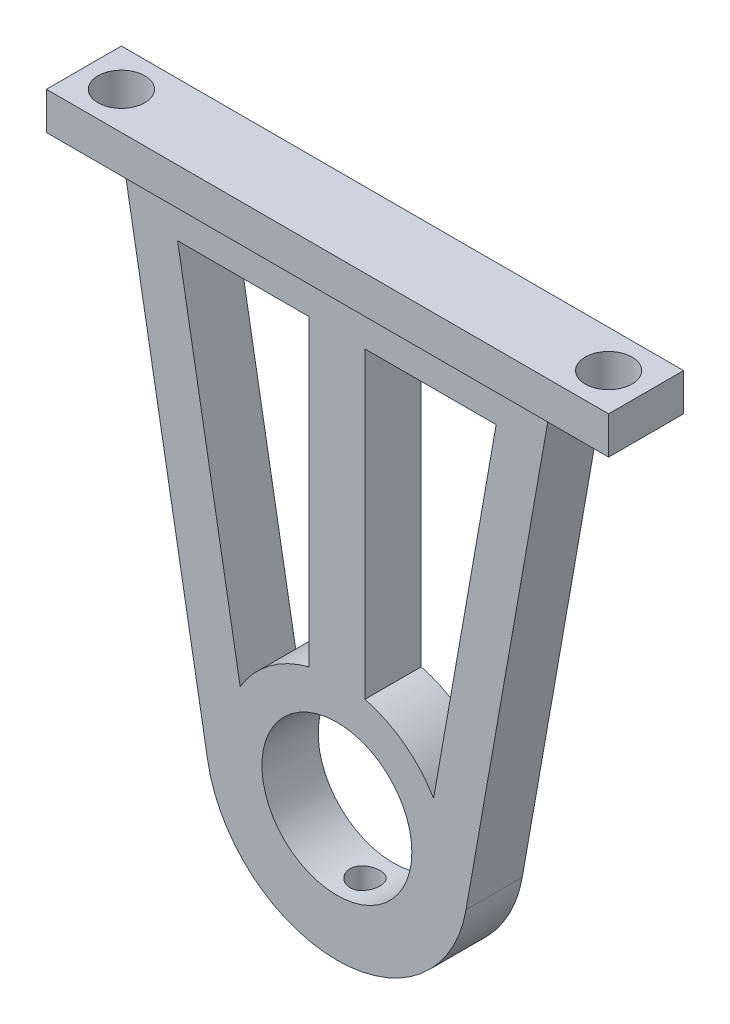
from build123d import *

# Parameters (mm, degrees)
SKETCH_1_R             = 4
EXTRUDE_1_DEPTH        = 1.5
SKETCH_2_W             = 30
SKETCH_2_H             = 4
EXTRUDE_2_DEPTH        = 2
HOLE_WIZARD_M3_1_D     = 2.5
HOLE_WIZARD_M3_1_DEPTH = 2
HOLE_WIZARD_M3_1_TIP   = 0.751075774
CUT_EXTRUDE_2_DEPTH    = 10
HOLE_WIZARD_M2_1_D     = 1.6
HOLE_WIZARD_M2_1_DEPTH = 4.2
HOLE_WIZARD_M2_1_TIP   = 0.480688495


with BuildPart() as part:
    # 草图1 → 凸台-拉伸1 (new, symmetric)
    with BuildSketch(Plane.XY):
        with BuildLine():
            Line((11.33983382, 24), (6.893654271, -1.215537244))
            ThreePointArc((6.893654271, -1.215537244), (0, -7), (-6.893654271, -1.215537244))
            Line((-6.893654271, -1.215537244), (-11.33983382, 24))
            Line((-11.33983382, 24), (11.33983382, 24))
        make_face()
        Circle(SKETCH_1_R, mode=Mode.SUBTRACT)
    extrude(amount=EXTRUDE_1_DEPTH, both=True)

    # 草图2 → 凸台-拉伸2 (add)
    with BuildSketch(Plane(origin=(0, 24, 0), x_dir=(1, 0, 0), z_dir=(0, 1, 0))):
        Rectangle(SKETCH_2_W, SKETCH_2_H)
    extrude(amount=EXTRUDE_2_DEPTH)

    # M3 螺纹孔1
    with Locations(Plane(origin=(0, 26, 0), x_dir=(1, 0, 0), z_dir=(0, 1, 0))):
        with Locations((-13, 0), (13, 0)):
            Hole(HOLE_WIZARD_M3_1_D / 2, depth=HOLE_WIZARD_M3_1_DEPTH)
            with Locations((0, 0, -(HOLE_WIZARD_M3_1_DEPTH + HOLE_WIZARD_M3_1_TIP / 2))):  # 118° drill point
                Cone(0, HOLE_WIZARD_M3_1_D / 2, HOLE_WIZARD_M3_1_TIP, mode=Mode.SUBTRACT)

    # 草图8 → 切除-拉伸2 (cut)
    with BuildSketch(Plane(origin=(0, 0, -1.5), x_dir=(-1, 0, 0), z_dir=(0, 0, -1))):
        with BuildLine():
            Line((-1.5, 22), (-8.5, 22))
            Line((-8.5, 22), (-5.160522702, 3.060883114))
            ThreePointArc((-5.160522702, 3.060883114), (-3.602683726, 4.797986033), (-1.5, 5.809475019))
            Line((-1.5, 5.809475019), (-1.5, 22))
        make_face()
        with BuildLine():
            Line((8.5, 22), (1.5, 22))
            Line((1.5, 22), (1.5, 5.809475019))
            ThreePointArc((1.5, 5.809475019), (3.602683726, 4.797986033), (5.160522702, 3.060883114))
            Line((5.160522702, 3.060883114), (8.5, 22))
        make_face()
    extrude(amount=-CUT_EXTRUDE_2_DEPTH, mode=Mode.SUBTRACT)

    # M2 螺纹孔1
    with Locations(Plane(origin=(0, -7, 0), x_dir=(-1, 0, 0), z_dir=(0, -1, 0))):
        with Locations((0, 0)):
            Hole(HOLE_WIZARD_M2_1_D / 2, depth=HOLE_WIZARD_M2_1_DEPTH)
            with Locations((0, 0, -(HOLE_WIZARD_M2_1_DEPTH + HOLE_WIZARD_M2_1_TIP / 2))):  # 118° drill point
                Cone(0, HOLE_WIZARD_M2_1_D / 2, HOLE_WIZARD_M2_1_TIP, mode=Mode.SUBTRACT)


solid = part.part
